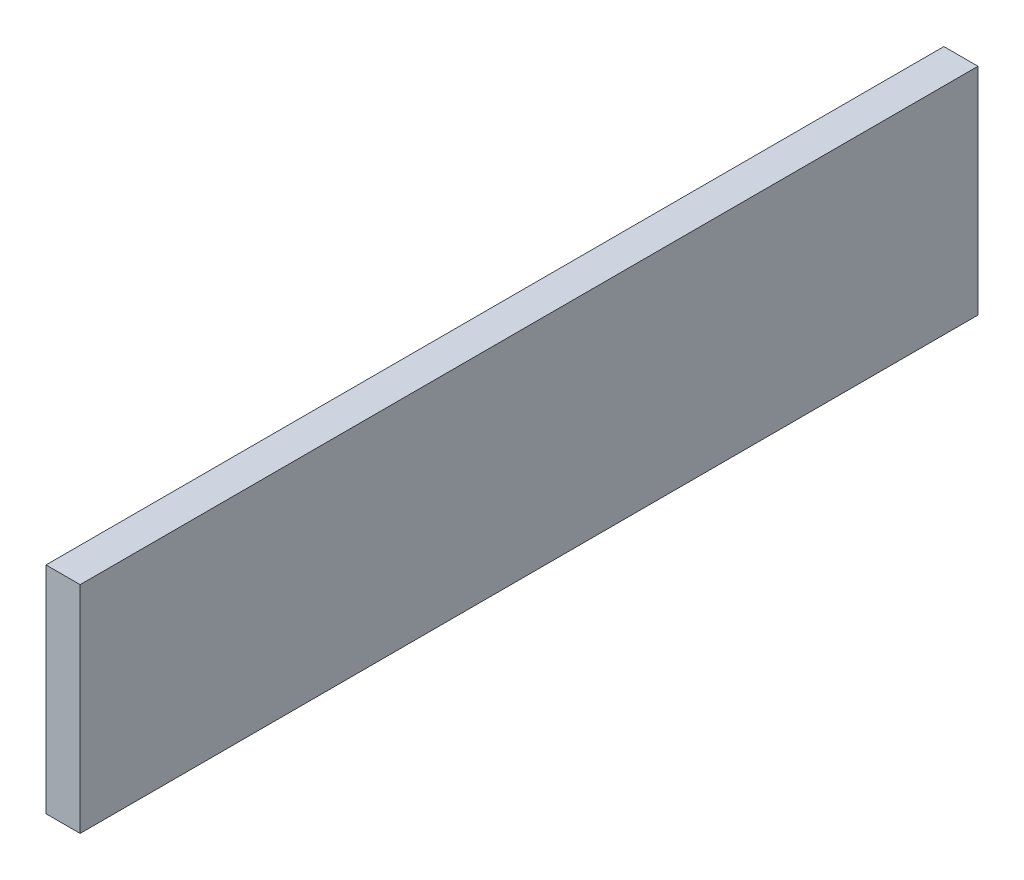
from build123d import *

# Parameters (mm, degrees)
SKETCH1_W           = 500
SKETCH1_H           = 120
BOSS_EXTRUDE1_DEPTH = 19


with BuildPart() as part:
    # Sketch1 → Boss-Extrude1 (new body)
    with BuildSketch(Plane(origin=(0, 0, 0), x_dir=(0, 0, -1), z_dir=(1, 0, 0))):
        with Locations((250, 60)):
            Rectangle(SKETCH1_W, SKETCH1_H)
    extrude(amount=BOSS_EXTRUDE1_DEPTH)


solid = part.part
